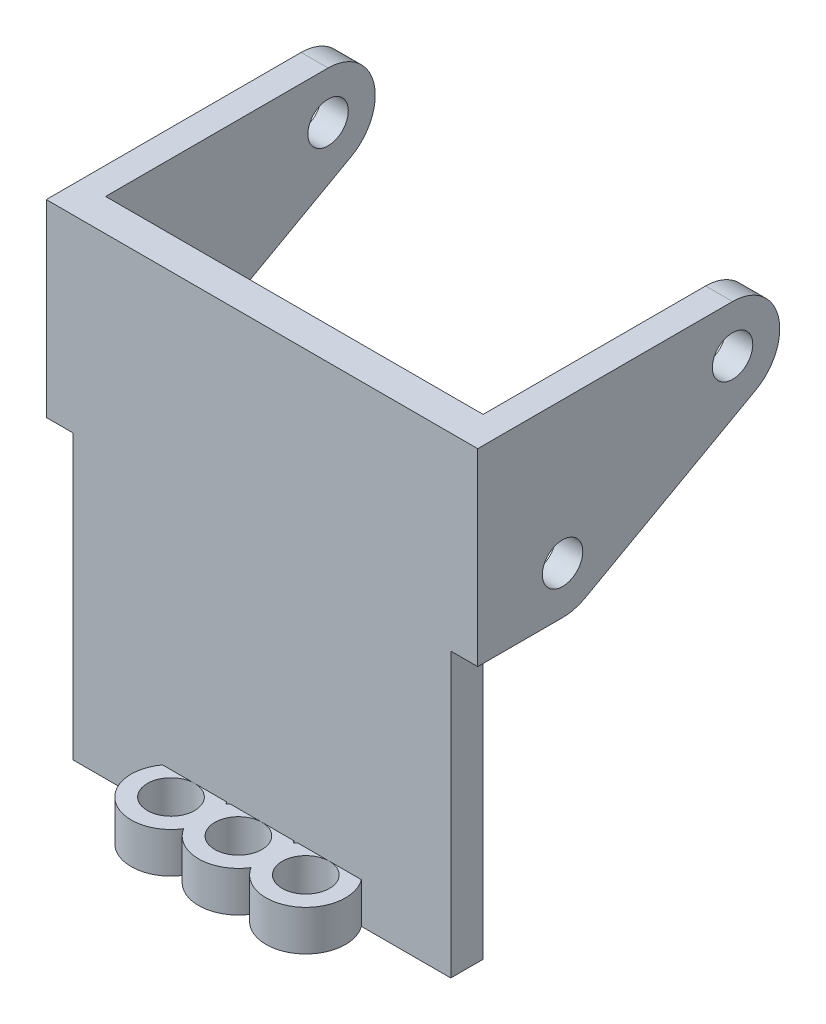
from build123d import *

# Parameters (mm, degrees)
SKETCH2_R                = 2.95
SKETCH2_R_2              = 1.75
EXTRUDE_THIN1_DEPTH      = 3
EXTRUDE_THIN2_DEPTH      = 14
EXTRUDE_THIN2_DEPTH_BACK = 14
SKETCH3_W                = 2.4
SKETCH3_H                = 35
SKETCH4_R                = 1.5
BOSS_EXTRUDE1_DEPTH      = 2
BOSS_EXTRUDE2_START      = -30
SKETCH4_2_R              = 1.5
BOSS_EXTRUDE2_DEPTH      = 2


with BuildPart() as part:
    # Sketch2 → Extrude-Thin1 (new body)
    # profile 1 of 3: a face of its own
    with BuildSketch(Plane(origin=(0, 0, 0), x_dir=(1, 0, 0), z_dir=(0, 1, 0))):
        Circle(SKETCH2_R)
        Circle(SKETCH2_R_2, mode=Mode.SUBTRACT)
    # profile 2 of 3: a face of its own
    with BuildSketch(Plane(origin=(0, 0, 0), x_dir=(1, 0, 0), z_dir=(0, 1, 0))):
        with Locations((5, 0)):
            Circle(SKETCH2_R)
        with Locations((5, 0)):
            Circle(SKETCH2_R_2, mode=Mode.SUBTRACT)
    # profile 3 of 3: a face of its own
    with BuildSketch(Plane(origin=(0, 0, 0), x_dir=(1, 0, 0), z_dir=(0, 1, 0))):
        with Locations((-5, 0)):
            Circle(SKETCH2_R)
        with Locations((-5, 0)):
            Circle(SKETCH2_R_2, mode=Mode.SUBTRACT)
    extrude(amount=EXTRUDE_THIN1_DEPTH)

    # Sketch3 → Extrude-Thin2 (add, two sides: drawn at the far end of the back side and taken through both)
    with BuildSketch(Plane(origin=(0, 0, 0), x_dir=(0, 0, -1), z_dir=(1, 0, 0)).offset(-EXTRUDE_THIN2_DEPTH_BACK)):
        with Locations((2.95, 17.5)):
            Rectangle(SKETCH3_W, SKETCH3_H)
    extrude(amount=EXTRUDE_THIN2_DEPTH + EXTRUDE_THIN2_DEPTH_BACK)

    # Sketch4 → Boss-Extrude1 (add)
    with BuildSketch(Plane(origin=(14, 0, 0), x_dir=(0, 0, -1), z_dir=(1, 0, 0))):
        with BuildLine():
            Line((20.65, 35), (1.75, 35))
            Line((1.75, 35), (1.75, 21))
            Line((1.75, 21), (8.04152842, 21))
            ThreePointArc((8.04152842, 21), (8.918989705, 21.111776027), (9.740405769, 21.439964746))
            Line((9.740405769, 21.439964746), (22.348877349, 28.439964746))
            ThreePointArc((22.348877349, 28.439964746), (24.038223973, 32.377461285), (20.65, 35))
        make_face()
        with Locations(Location((20.65, 31.5, 0), (0, 0, 90))):
            Circle(SKETCH4_R, mode=Mode.SUBTRACT)
        with Locations(Location((8.04152842, 24.5, 0), (0, 0, 90))):
            Circle(SKETCH4_R, mode=Mode.SUBTRACT)
    extrude(amount=BOSS_EXTRUDE1_DEPTH)

    # Sketch4<2> → Boss-Extrude2 (add)
    with BuildSketch(Plane(origin=(14, 0, 0), x_dir=(0, 0, -1), z_dir=(1, 0, 0)).offset(BOSS_EXTRUDE2_START)):
        with BuildLine():
            Line((20.65, 35), (1.75, 35))
            Line((1.75, 35), (1.75, 21))
            Line((1.75, 21), (8.04152842, 21))
            ThreePointArc((8.04152842, 21), (8.918989705, 21.111776027), (9.740405769, 21.439964746))
            Line((9.740405769, 21.439964746), (22.348877349, 28.439964746))
            ThreePointArc((22.348877349, 28.439964746), (24.038223973, 32.377461285), (20.65, 35))
        make_face()
        with Locations(Location((20.65, 31.5, 0), (0, 0, 90))):
            Circle(SKETCH4_2_R, mode=Mode.SUBTRACT)
        with Locations(Location((8.04152842, 24.5, 0), (0, 0, 90))):
            Circle(SKETCH4_2_R, mode=Mode.SUBTRACT)
    extrude(amount=BOSS_EXTRUDE2_DEPTH)


solid = part.part
